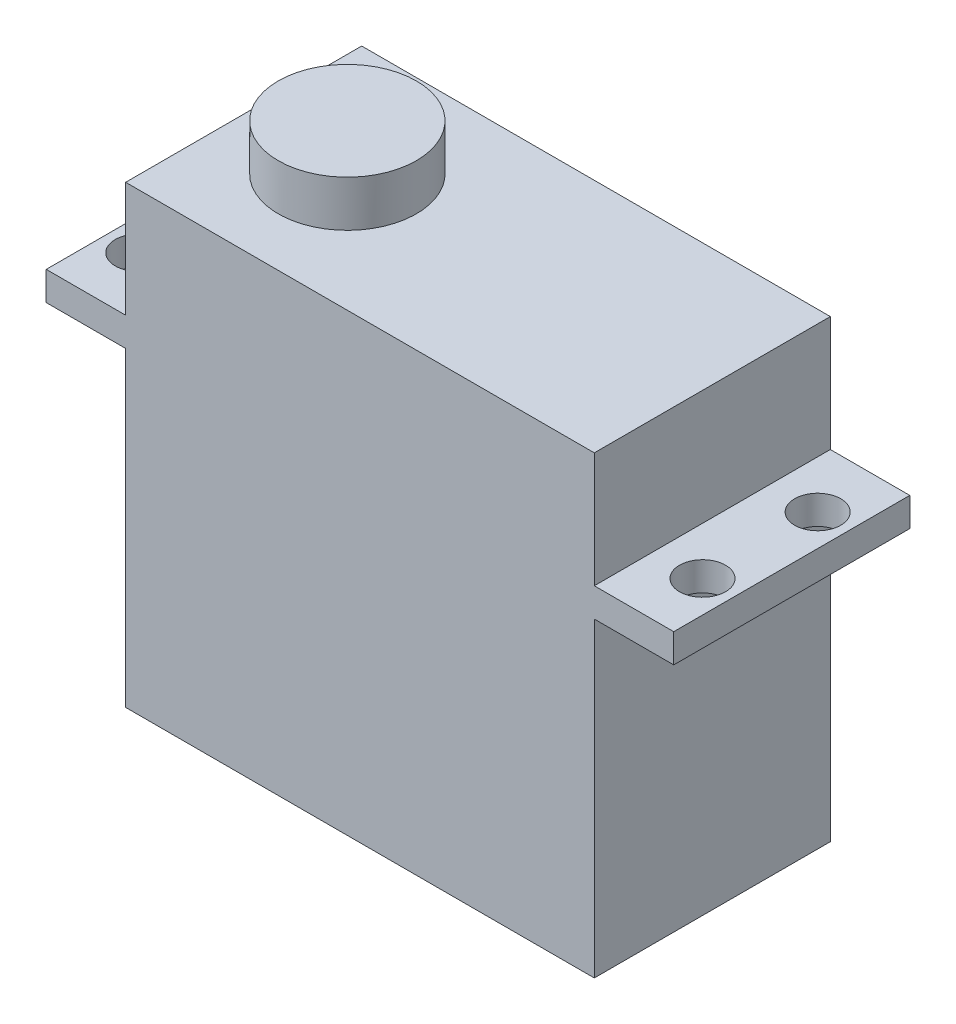
from build123d import *

# Parameters (mm, degrees)
SKETCH2_W           = 40.7
SKETCH2_H           = 20.5
BOSS_EXTRUDE1_DEPTH = 27
SKETCH3_W           = 54.5
SKETCH3_H           = 20.5
SKETCH3_R           = 2
BOSS_EXTRUDE2_DEPTH = 2.5
SKETCH4_W           = 40.7
SKETCH4_H           = 20.5
BOSS_EXTRUDE3_DEPTH = 10
SKETCH5_R           = 6
BOSS_EXTRUDE4_DEPTH = 4


with BuildPart() as part:
    # Sketch2 → Boss-Extrude1 (new body)
    with BuildSketch(Plane(origin=(0, 0, 0), x_dir=(1, 0, 0), z_dir=(0, 1, 0))):
        Rectangle(SKETCH2_W, SKETCH2_H)
    extrude(amount=BOSS_EXTRUDE1_DEPTH)

    # Sketch3 → Boss-Extrude2 (add)
    with BuildSketch(Plane(origin=(0, 27, 0), x_dir=(1, 0, 0), z_dir=(0, 1, 0))):
        Rectangle(SKETCH3_W, SKETCH3_H)
        with Locations(Location((-24.5, 5, 0), (0, 0, 270))):
            Circle(SKETCH3_R, mode=Mode.SUBTRACT)
        with Locations(Location((-24.5, -5, 0), (0, 0, 90))):
            Circle(SKETCH3_R, mode=Mode.SUBTRACT)
        with Locations(Location((24.5, -5, 0), (0, 0, 270))):
            Circle(SKETCH3_R, mode=Mode.SUBTRACT)
        with Locations(Location((24.5, 5, 0), (0, 0, 90))):
            Circle(SKETCH3_R, mode=Mode.SUBTRACT)
    extrude(amount=BOSS_EXTRUDE2_DEPTH)

    # Sketch4 → Boss-Extrude3 (add)
    with BuildSketch(Plane(origin=(0, 29.5, 0), x_dir=(1, 0, 0), z_dir=(0, 1, 0))):
        Rectangle(SKETCH4_W, SKETCH4_H)
    extrude(amount=BOSS_EXTRUDE3_DEPTH)

    # Sketch5 → Boss-Extrude4 (add)
    with BuildSketch(Plane(origin=(0, 39.5, 0), x_dir=(1, 0, 0), z_dir=(0, 1, 0))):
        with Locations(Location((-11.35, 0, 0), (0, 0, 90))):
            Circle(SKETCH5_R)
    extrude(amount=BOSS_EXTRUDE4_DEPTH)


solid = part.part
